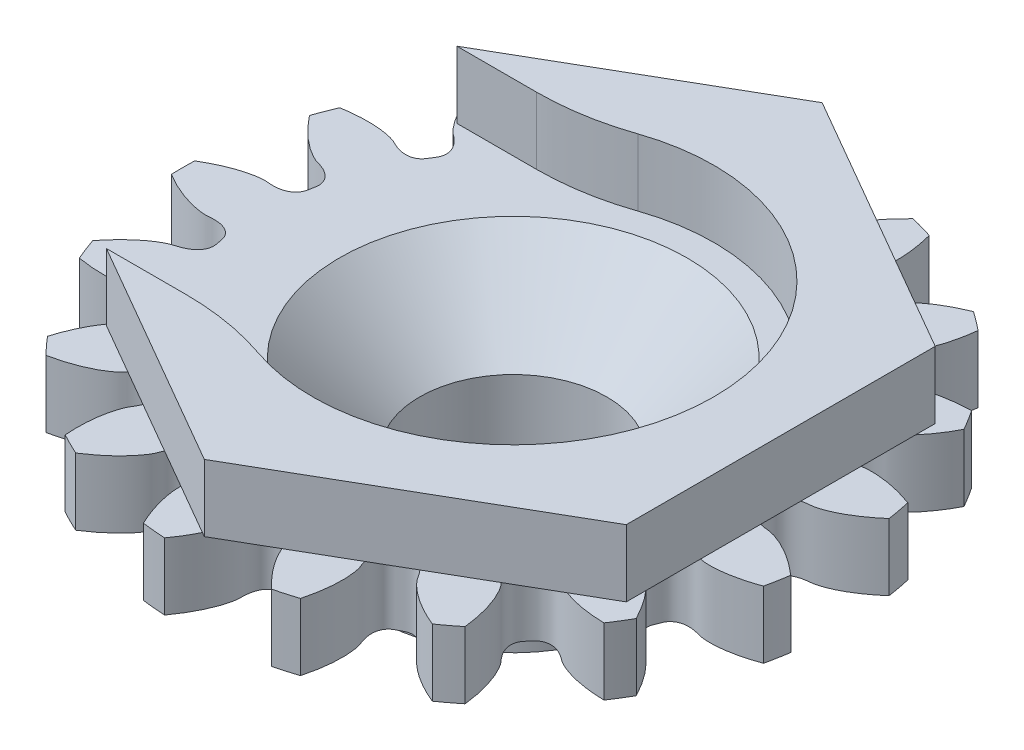
from build123d import *

# Parameters (mm, degrees)
EXTRUDE_1_DEPTH     = 5
SKETCH_2_R          = 15
CUT_EXTRUDE_1_DEPTH = 5
EXTRUDE_START       = 5
SKETCH_3_R          = 15
EXTRUDE_2_DEPTH     = 5
SKETCH_5_W          = 30.472293135
SKETCH_5_H          = 26.2
CUT_EXTRUDE_2_DEPTH = 5
FILLET_1_R          = 20
SKETCH_9_R          = 10
EXTRUDE_3_DEPTH     = 10
SKETCH_11_R         = 15
EXTRUDE_4_DEPTH     = 5
SKETCH_12_R         = 7
CUT_EXTRUDE_4_DEPTH = 20
CHAMFER_1_SIZE      = 6
SKETCH_13_R         = 12.355203176
CUT_EXTRUDE_5_DEPTH = 3
SKETCH_15_R         = 12
SKETCH_15_R_2       = 10
EXTRUDE_5_DEPTH     = 2.9


with BuildPart() as part:
    # 草图1 → 凸台-拉伸1 (new body)
    with BuildSketch(Plane(origin=(0, 0, 0), x_dir=(1, 0, 0), z_dir=(0, 1, 0))):
        with BuildLine():
            ThreePointArc((14.176553775, -20.226598941), (14.885075295, -19.711025218), (15.574863441, -19.170644498))
            add(Edge.make_bspline(
                [(15.574863441, -19.170644498), (15.549480584, -18.941240251), (15.500523651, -18.583545126), (15.413865314, -18.107757722), (15.33610302, -17.748051042), (15.252032601, -17.412716678), (15.163161506, -17.101758813), (15.070990267, -16.815108865), (14.977008929, -16.552626419), (14.882694077, -16.314099749), (14.789505703, -16.099246629), (14.698884311, -15.907715122), (14.612247524, -15.739084864), (14.530988404, -15.592867343), (14.456468632, -15.468509762), (14.3900274, -15.365388616), (14.332944525, -15.282833836), (14.286531146, -15.220068398), (14.177607251, -15.082670207), (14.036715386, -14.946149435), (13.901356566, -14.770704918), (13.822913693, -14.661721891), (13.751712494, -14.551979929), (13.687423627, -14.441444801), (13.630186007, -14.329601856), (13.580147144, -14.215874375), (13.537658748, -14.09948744), (13.503340489, -13.979491528), (13.478228337, -13.854788515), (13.463951482, -13.72425129), (13.462933372, -13.587001656), (13.478477076, -13.442906725), (13.514690312, -13.293412443), (13.575317954, -13.142110485), (13.656558282, -13.00836415), (13.77559226, -12.859232853), (13.933521688, -12.702083349), (14.075428932, -12.530327693), (14.212940991, -12.398041393), (14.338620875, -12.304807066), (14.483683393, -12.230477668), (14.629198622, -12.180625319), (14.771244678, -12.151852519), (14.908002769, -12.140202488), (15.039300447, -12.142373984), (15.165788556, -12.15587287), (15.288439076, -12.178972907), (15.408249859, -12.210541223), (15.526109202, -12.249873181), (15.642756267, -12.29654707), (15.758751699, -12.350362798), (15.87459514, -12.411134554), (15.99035106, -12.479187118), (16.177536497, -12.597780544), (16.326474757, -12.725474841), (16.47333706, -12.821256581), (16.540117239, -12.861680704), (16.627586798, -12.91090288), (16.736398471, -12.967545866), (16.867101381, -13.03027348), (17.02019281, -13.097694712), (17.196097555, -13.168402685), (17.395173509, -13.240965204), (17.617708443, -13.313931908), (17.863919876, -13.385835965), (18.133954122, -13.45519757), (18.427885761, -13.520526902), (18.745717125, -13.580327317), (19.087378051, -13.633098354), (19.452725285, -13.677339384), (19.934478887, -13.719727928), (20.295165323, -13.735472077), (20.525933007, -13.739579901)],
                knots=[0.010676911, 0.010676911, 0.010676911, 0.010676911, 0.058364616, 0.085243058, 0.110585589, 0.134392209, 0.156662918, 0.177397716, 0.196596603, 0.21425958, 0.230386645, 0.2449778, 0.258033043, 0.269552376, 0.279535798, 0.287983309, 0.29489491, 0.3002706, 0.304110379, 0.331113618, 0.34062545, 0.349862158, 0.358855237, 0.367643072, 0.376272627, 0.384801461, 0.393300011, 0.401853859, 0.410565316, 0.419552882, 0.42894596, 0.438870848, 0.449423906, 0.460632045, 0.472412501, 0.481614351, 0.5, 0.518385649, 0.527587499, 0.539367955, 0.550576094, 0.561129152, 0.57105404, 0.580447118, 0.589434684, 0.598146141, 0.606699989, 0.615198539, 0.623727373, 0.632356928, 0.641144763, 0.650137842, 0.65937455, 0.668886382, 0.695889621, 0.6997294, 0.70510509, 0.712016691, 0.720464202, 0.730447624, 0.741966957, 0.7550222, 0.769613355, 0.78574042, 0.803403397, 0.822602284, 0.843337082, 0.865607791, 0.889414411, 0.914756942, 0.941635384, 0.989323089, 0.989323089, 0.989323089, 0.989323089], degree=3))
            ThreePointArc((20.525933007, -13.739579901), (21.000362937, -13.002874228), (21.448363196, -12.249803994))
            add(Edge.make_bspline(
                [(21.448363196, -12.249803994), (21.341824014, -12.04506025), (21.166958651, -11.729204763), (20.914277924, -11.316850824), (20.711825703, -11.009525315), (20.512295628, -10.727205071), (20.317094862, -10.46934944), (20.127597837, -10.235352416), (19.945143253, -10.024544799), (19.771031502, -9.836195758), (19.606522031, -9.669514713), (19.452830939, -9.523653125), (19.311128266, -9.39770691), (19.182536532, -9.290717312), (19.068125774, -9.201676968), (18.968919516, -9.129520704), (18.885869094, -9.073161377), (18.819916416, -9.031400795), (18.668713957, -8.942628648), (18.488019214, -8.866222831), (18.298423004, -8.751522937), (18.185907993, -8.678236125), (18.079871483, -8.601625632), (17.979994006, -8.521778513), (17.886219183, -8.438164685), (17.798476228, -8.35019309), (17.716813169, -8.257014084), (17.641464823, -8.157518413), (17.573000514, -8.050307873), (17.512532259, -7.933742931), (17.462002612, -7.806129242), (17.424443591, -7.666149687), (17.404207865, -7.513668691), (17.406084886, -7.350682587), (17.433524488, -7.196620452), (17.490647928, -7.014559626), (17.581143785, -6.810971388), (17.651423049, -6.5995512), (17.731861902, -6.426522813), (17.815374781, -6.294183581), (17.923790674, -6.172470856), (18.041470839, -6.073418761), (18.163530907, -5.99527597), (18.286845553, -5.935009919), (18.410061426, -5.889604587), (18.532884435, -5.856499149), (18.655597335, -5.833732813), (18.778721354, -5.819888744), (18.90283026, -5.813988997), (19.028460962, -5.815373323), (19.156063965, -5.823652611), (19.286038047, -5.838473109), (19.418560649, -5.860114374), (19.635946758, -5.903080271), (19.82095605, -5.968348951), (19.992501424, -6.004609981), (20.069374964, -6.01818057), (20.168719, -6.032481232), (20.290644669, -6.045991934), (20.435181331, -6.057268355), (20.602290195, -6.064833779), (20.791859151, -6.067222876), (21.003704555, -6.062970881), (21.237570814, -6.050621416), (21.49313088, -6.028728124), (21.769986617, -5.995858274), (22.067669385, -5.950595707), (22.385640707, -5.891544001), (22.72329313, -5.817329366), (23.079950983, -5.726604253), (23.544485346, -5.59210092), (23.886502874, -5.476486932), (24.103171248, -5.396954462)],
                knots=[0.010676911, 0.010676911, 0.010676911, 0.010676911, 0.058364616, 0.085243058, 0.110585589, 0.134392209, 0.156662918, 0.177397716, 0.196596603, 0.21425958, 0.230386645, 0.2449778, 0.258033043, 0.269552376, 0.279535798, 0.287983309, 0.29489491, 0.3002706, 0.304110379, 0.331113618, 0.34062545, 0.349862158, 0.358855237, 0.367643072, 0.376272627, 0.384801461, 0.393300011, 0.401853859, 0.410565316, 0.419552882, 0.42894596, 0.438870848, 0.449423906, 0.460632045, 0.472412501, 0.481614351, 0.5, 0.518385649, 0.527587499, 0.539367955, 0.550576094, 0.561129152, 0.57105404, 0.580447118, 0.589434684, 0.598146141, 0.606699989, 0.615198539, 0.623727373, 0.632356928, 0.641144763, 0.650137842, 0.65937455, 0.668886382, 0.695889621, 0.6997294, 0.70510509, 0.712016691, 0.720464202, 0.730447624, 0.741966957, 0.7550222, 0.769613355, 0.78574042, 0.803403397, 0.822602284, 0.843337082, 0.865607791, 0.889414411, 0.914756942, 0.941635384, 0.989323089, 0.989323089, 0.989323089, 0.989323089], degree=3))
            ThreePointArc((24.103171248, -5.396954462), (24.279435198, -4.538613022), (24.425142652, -3.674559583))
            add(Edge.make_bspline(
                [(24.425142652, -3.674559583), (24.251835852, -3.522128119), (23.974678595, -3.290770304), (23.59010141, -2.997540514), (23.290301557, -2.784102188), (23.002259468, -2.592924978), (22.727091977, -2.422996413), (22.465861788, -2.273254907), (22.219575461, -2.142592856), (21.989181566, -2.029859025), (21.775568915, -1.933861255), (21.579564957, -1.853369001), (21.401934129, -1.787116563), (21.243376808, -1.733804426), (21.104526871, -1.692106711), (20.985953941, -1.660660433), (20.888152392, -1.638108199), (20.811567689, -1.62299247), (20.638507396, -1.594835537), (20.442413602, -1.588863704), (20.22418602, -1.550399289), (20.092794648, -1.522706482), (19.966243644, -1.489574131), (19.844266564, -1.451198815), (19.726619347, -1.407106617), (19.613022473, -1.356771958), (19.503213799, -1.299385223), (19.397011577, -1.233827235), (19.294441596, -1.158588544), (19.195948513, -1.071738626), (19.10273164, -0.970995819), (19.017142448, -0.854036654), (18.943190706, -0.719162347), (18.886063604, -0.566504273), (18.855996608, -0.412933284), (18.843494674, -0.222531253), (18.854334993, 0), (18.843494674, 0.222531253), (18.855996608, 0.412933284), (18.886063604, 0.566504273), (18.943190706, 0.719162347), (19.017142448, 0.854036654), (19.10273164, 0.970995819), (19.195948513, 1.071738626), (19.294441596, 1.158588544), (19.397011577, 1.233827235), (19.503213799, 1.299385223), (19.613022473, 1.356771958), (19.726619347, 1.407106617), (19.844266564, 1.451198815), (19.966243644, 1.489574131), (20.092794648, 1.522706482), (20.22418602, 1.550399289), (20.442413602, 1.588863704), (20.638507396, 1.594835537), (20.811567689, 1.62299247), (20.888152392, 1.638108199), (20.985953941, 1.660660433), (21.104526871, 1.692106711), (21.243376808, 1.733804426), (21.401934129, 1.787116563), (21.579564957, 1.853369001), (21.775568915, 1.933861255), (21.989181566, 2.029859025), (22.219575461, 2.142592856), (22.465861788, 2.273254907), (22.727091977, 2.422996413), (23.002259468, 2.592924978), (23.290301557, 2.784102188), (23.59010141, 2.997540514), (23.974678595, 3.290770304), (24.251835852, 3.522128119), (24.425142652, 3.674559583)],
                knots=[0.010676911, 0.010676911, 0.010676911, 0.010676911, 0.058364616, 0.085243058, 0.110585589, 0.134392209, 0.156662918, 0.177397716, 0.196596603, 0.21425958, 0.230386645, 0.2449778, 0.258033043, 0.269552376, 0.279535798, 0.287983309, 0.29489491, 0.3002706, 0.304110379, 0.331113618, 0.34062545, 0.349862158, 0.358855237, 0.367643072, 0.376272627, 0.384801461, 0.393300011, 0.401853859, 0.410565316, 0.419552882, 0.42894596, 0.438870848, 0.449423906, 0.460632045, 0.472412501, 0.481614351, 0.5, 0.518385649, 0.527587499, 0.539367955, 0.550576094, 0.561129152, 0.57105404, 0.580447118, 0.589434684, 0.598146141, 0.606699989, 0.615198539, 0.623727373, 0.632356928, 0.641144763, 0.650137842, 0.65937455, 0.668886382, 0.695889621, 0.6997294, 0.70510509, 0.712016691, 0.720464202, 0.730447624, 0.741966957, 0.7550222, 0.769613355, 0.78574042, 0.803403397, 0.822602284, 0.843337082, 0.865607791, 0.889414411, 0.914756942, 0.941635384, 0.989323089, 0.989323089, 0.989323089, 0.989323089], degree=3))
            ThreePointArc((24.425142652, 3.674559583), (24.279435198, 4.538613022), (24.103171248, 5.396954462))
            add(Edge.make_bspline(
                [(24.103171248, 5.396954462), (23.886502874, 5.476486932), (23.544485346, 5.59210092), (23.079950983, 5.726604253), (22.72329313, 5.817329366), (22.385640707, 5.891544001), (22.067669385, 5.950595707), (21.769986617, 5.995858274), (21.49313088, 6.028728124), (21.237570814, 6.050621416), (21.003704555, 6.062970881), (20.791859151, 6.067222876), (20.602290195, 6.064833779), (20.435181331, 6.057268355), (20.290644669, 6.045991934), (20.168719, 6.032481232), (20.069374964, 6.01818057), (19.992501424, 6.004609981), (19.82095605, 5.968348951), (19.635946758, 5.903080271), (19.418560649, 5.860114374), (19.286038047, 5.838473109), (19.156063965, 5.823652611), (19.028460962, 5.815373323), (18.90283026, 5.813988997), (18.778721354, 5.819888744), (18.655597335, 5.833732813), (18.532884435, 5.856499149), (18.410061426, 5.889604587), (18.286845553, 5.935009919), (18.163530907, 5.99527597), (18.041470839, 6.073418761), (17.923790674, 6.172470856), (17.815374781, 6.294183581), (17.731861902, 6.426522813), (17.651423049, 6.5995512), (17.581143785, 6.810971388), (17.490647928, 7.014559626), (17.433524488, 7.196620452), (17.406084886, 7.350682587), (17.404207865, 7.513668691), (17.424443591, 7.666149687), (17.462002612, 7.806129242), (17.512532259, 7.933742931), (17.573000514, 8.050307873), (17.641464823, 8.157518413), (17.716813169, 8.257014084), (17.798476228, 8.35019309), (17.886219183, 8.438164685), (17.979994006, 8.521778513), (18.079871483, 8.601625632), (18.185907993, 8.678236125), (18.298423004, 8.751522937), (18.488019214, 8.866222831), (18.668713957, 8.942628648), (18.819916416, 9.031400795), (18.885869094, 9.073161377), (18.968919516, 9.129520704), (19.068125774, 9.201676968), (19.182536532, 9.290717312), (19.311128266, 9.39770691), (19.452830939, 9.523653125), (19.606522031, 9.669514713), (19.771031502, 9.836195758), (19.945143253, 10.024544799), (20.127597837, 10.235352416), (20.317094862, 10.46934944), (20.512295628, 10.727205071), (20.711825703, 11.009525315), (20.914277924, 11.316850824), (21.166958651, 11.729204763), (21.341824014, 12.04506025), (21.448363196, 12.249803994)],
                knots=[0.010676911, 0.010676911, 0.010676911, 0.010676911, 0.058364616, 0.085243058, 0.110585589, 0.134392209, 0.156662918, 0.177397716, 0.196596603, 0.21425958, 0.230386645, 0.2449778, 0.258033043, 0.269552376, 0.279535798, 0.287983309, 0.29489491, 0.3002706, 0.304110379, 0.331113618, 0.34062545, 0.349862158, 0.358855237, 0.367643072, 0.376272627, 0.384801461, 0.393300011, 0.401853859, 0.410565316, 0.419552882, 0.42894596, 0.438870848, 0.449423906, 0.460632045, 0.472412501, 0.481614351, 0.5, 0.518385649, 0.527587499, 0.539367955, 0.550576094, 0.561129152, 0.57105404, 0.580447118, 0.589434684, 0.598146141, 0.606699989, 0.615198539, 0.623727373, 0.632356928, 0.641144763, 0.650137842, 0.65937455, 0.668886382, 0.695889621, 0.6997294, 0.70510509, 0.712016691, 0.720464202, 0.730447624, 0.741966957, 0.7550222, 0.769613355, 0.78574042, 0.803403397, 0.822602284, 0.843337082, 0.865607791, 0.889414411, 0.914756942, 0.941635384, 0.989323089, 0.989323089, 0.989323089, 0.989323089], degree=3))
            ThreePointArc((21.448363196, 12.249803994), (21.000362937, 13.002874228), (20.525933007, 13.739579901))
            add(Edge.make_bspline(
                [(20.525933007, 13.739579901), (20.295165323, 13.735472077), (19.934478887, 13.719727928), (19.452725285, 13.677339384), (19.087378051, 13.633098354), (18.745717125, 13.580327317), (18.427885761, 13.520526902), (18.133954122, 13.45519757), (17.863919876, 13.385835965), (17.617708443, 13.313931908), (17.395173509, 13.240965204), (17.196097555, 13.168402685), (17.02019281, 13.097694712), (16.867101381, 13.03027348), (16.736398471, 12.967545866), (16.627586798, 12.91090288), (16.540117239, 12.861680704), (16.47333706, 12.821256581), (16.326474757, 12.725474841), (16.177536497, 12.597780544), (15.99035106, 12.479187118), (15.87459514, 12.411134554), (15.758751699, 12.350362798), (15.642756267, 12.29654707), (15.526109202, 12.249873181), (15.408249859, 12.210541223), (15.288439076, 12.178972907), (15.165788556, 12.15587287), (15.039300447, 12.142373984), (14.908002769, 12.140202488), (14.771244678, 12.151852519), (14.629198622, 12.180625319), (14.483683393, 12.230477668), (14.338620875, 12.304807066), (14.212940991, 12.398041393), (14.075428932, 12.530327693), (13.933521688, 12.702083349), (13.77559226, 12.859232853), (13.656558282, 13.00836415), (13.575317954, 13.142110485), (13.514690312, 13.293412443), (13.478477076, 13.442906725), (13.462933372, 13.587001656), (13.463951482, 13.72425129), (13.478228337, 13.854788515), (13.503340489, 13.979491528), (13.537658748, 14.09948744), (13.580147144, 14.215874375), (13.630186007, 14.329601856), (13.687423627, 14.441444801), (13.751712494, 14.551979929), (13.822913693, 14.661721891), (13.901356566, 14.770704918), (14.036715386, 14.946149435), (14.177607251, 15.082670207), (14.286531146, 15.220068398), (14.332944525, 15.282833836), (14.3900274, 15.365388616), (14.456468632, 15.468509762), (14.530988404, 15.592867343), (14.612247524, 15.739084864), (14.698884311, 15.907715122), (14.789505703, 16.099246629), (14.882694077, 16.314099749), (14.977008929, 16.552626419), (15.070990267, 16.815108865), (15.163161506, 17.101758813), (15.252032601, 17.412716678), (15.33610302, 17.748051042), (15.413865314, 18.107757722), (15.500523651, 18.583545126), (15.549480584, 18.941240251), (15.574863441, 19.170644498)],
                knots=[0.010676911, 0.010676911, 0.010676911, 0.010676911, 0.058364616, 0.085243058, 0.110585589, 0.134392209, 0.156662918, 0.177397716, 0.196596603, 0.21425958, 0.230386645, 0.2449778, 0.258033043, 0.269552376, 0.279535798, 0.287983309, 0.29489491, 0.3002706, 0.304110379, 0.331113618, 0.34062545, 0.349862158, 0.358855237, 0.367643072, 0.376272627, 0.384801461, 0.393300011, 0.401853859, 0.410565316, 0.419552882, 0.42894596, 0.438870848, 0.449423906, 0.460632045, 0.472412501, 0.481614351, 0.5, 0.518385649, 0.527587499, 0.539367955, 0.550576094, 0.561129152, 0.57105404, 0.580447118, 0.589434684, 0.598146141, 0.606699989, 0.615198539, 0.623727373, 0.632356928, 0.641144763, 0.650137842, 0.65937455, 0.668886382, 0.695889621, 0.6997294, 0.70510509, 0.712016691, 0.720464202, 0.730447624, 0.741966957, 0.7550222, 0.769613355, 0.78574042, 0.803403397, 0.822602284, 0.843337082, 0.865607791, 0.889414411, 0.914756942, 0.941635384, 0.989323089, 0.989323089, 0.989323089, 0.989323089], degree=3))
            ThreePointArc((15.574863441, 19.170644498), (14.885075295, 19.711025218), (14.176553775, 20.226598941))
            add(Edge.make_bspline(
                [(14.176553775, 20.226598941), (13.962853236, 20.139405606), (13.632210593, 19.994429656), (13.198301247, 19.780874041), (12.8736068, 19.607641867), (12.574080572, 19.435012178), (12.299314053, 19.26443602), (12.048830639, 19.097337877), (11.822087505, 18.935112486), (11.618476922, 18.779122121), (11.437327891, 18.630693805), (11.277907698, 18.491116742), (11.139424073, 18.361639398), (11.021025926, 18.243467969), (10.92180892, 18.137760873), (10.840806863, 18.045635551), (10.777025029, 17.96813959), (10.729357244, 17.906321435), (10.627012581, 17.76395484), (10.53426029, 17.591080749), (10.402555954, 17.412876493), (10.319200195, 17.307603506), (10.233132695, 17.209088053), (10.144410658, 17.117003998), (10.052501063, 17.031344113), (9.956808841, 16.952092449), (9.856492404, 16.879375224), (9.750468896, 16.813528602), (9.637398607, 16.755248491), (9.515751604, 16.705793439), (9.384020005, 16.667254049), (9.241172069, 16.642770932), (9.087474412, 16.636690699), (8.925356768, 16.653598173), (8.774483642, 16.695135783), (8.598470142, 16.768813999), (8.404100279, 16.877708569), (8.200066525, 16.967195428), (8.035198207, 17.063256189), (7.911129108, 17.15862354), (7.799938944, 17.277807183), (7.712167544, 17.40412472), (7.645620379, 17.532874208), (7.596989452, 17.661223465), (7.563146738, 17.788103197), (7.541515199, 17.913456848), (7.530168498, 18.037746889), (7.527743937, 18.161623053), (7.533320683, 18.285746892), (7.546290842, 18.410713946), (7.566308532, 18.537008701), (7.593058303, 18.665060873), (7.626834893, 18.795021353), (7.689675365, 19.007515738), (7.771736124, 19.185713579), (7.823670681, 19.353181426), (7.844276376, 19.4284749), (7.867682345, 19.526075653), (7.892385294, 19.646234599), (7.916949773, 19.789114236), (7.939901785, 19.954812194), (7.959771907, 20.143352044), (7.975084678, 20.354686078), (7.98436635, 20.58869417), (7.986146559, 20.845184119), (7.97896195, 21.123891686), (7.961359166, 21.424480894), (7.931898057, 21.74654441), (7.889154643, 22.08960413), (7.831724783, 22.453111601), (7.740657041, 22.928074745), (7.657093638, 23.279300799), (7.597892075, 23.502383234)],
                knots=[0.010676911, 0.010676911, 0.010676911, 0.010676911, 0.058364616, 0.085243058, 0.110585589, 0.134392209, 0.156662918, 0.177397716, 0.196596603, 0.21425958, 0.230386645, 0.2449778, 0.258033043, 0.269552376, 0.279535798, 0.287983309, 0.29489491, 0.3002706, 0.304110379, 0.331113618, 0.34062545, 0.349862158, 0.358855237, 0.367643072, 0.376272627, 0.384801461, 0.393300011, 0.401853859, 0.410565316, 0.419552882, 0.42894596, 0.438870848, 0.449423906, 0.460632045, 0.472412501, 0.481614351, 0.5, 0.518385649, 0.527587499, 0.539367955, 0.550576094, 0.561129152, 0.57105404, 0.580447118, 0.589434684, 0.598146141, 0.606699989, 0.615198539, 0.623727373, 0.632356928, 0.641144763, 0.650137842, 0.65937455, 0.668886382, 0.695889621, 0.6997294, 0.70510509, 0.712016691, 0.720464202, 0.730447624, 0.741966957, 0.7550222, 0.769613355, 0.78574042, 0.803403397, 0.822602284, 0.843337082, 0.865607791, 0.889414411, 0.914756942, 0.941635384, 0.989323089, 0.989323089, 0.989323089, 0.989323089], degree=3))
            ThreePointArc((7.597892075, 23.502383234), (6.759475753, 23.75709303), (5.912552401, 23.981903715))
            add(Edge.make_bspline(
                [(5.912552401, 23.981903715), (5.744780449, 23.823400812), (5.48883672, 23.568772865), (5.161373491, 23.21289205), (4.921183615, 22.934064695), (4.704244762, 22.66489095), (4.509651829, 22.406576305), (4.336445813, 22.160276881), (4.183616709, 21.927097142), (4.050105714, 21.708087832), (3.934807764, 21.504243972), (3.836573912, 21.31650302), (3.75421439, 21.145742937), (3.686499849, 20.992781017), (3.632168554, 20.85837077), (3.58991589, 20.743205148), (3.558435871, 20.64790166), (3.536318279, 20.573038357), (3.492313469, 20.403314304), (3.468273858, 20.208608022), (3.409838025, 19.994860409), (3.370140084, 19.866584699), (3.325472416, 19.743630608), (3.276006178, 19.625714687), (3.221246953, 19.512637648), (3.160645616, 19.404169655), (3.093371816, 19.300124384), (3.018294382, 19.20042413), (2.933912683, 19.105233845), (2.838345455, 19.015174416), (2.729431431, 18.931650563), (2.60507402, 18.85721811), (2.463951657, 18.796026464), (2.306673771, 18.753228566), (2.150983656, 18.737459574), (1.960240314, 18.742579055), (1.739658559, 18.773905724), (1.517076366, 18.783644242), (1.32864009, 18.813660928), (1.17849844, 18.857769406), (1.031762602, 18.928738324), (0.904287051, 19.014819232), (0.795723988, 19.110834945), (0.7040119, 19.212949546), (0.626620263, 19.319035974), (0.561166491, 19.42811056), (0.505687267, 19.53990867), (0.458677199, 19.6545439), (0.419038657, 19.772300486), (0.385989663, 19.893514155), (0.359032676, 20.01851173), (0.337718315, 20.147579957), (0.322266906, 20.280966007), (0.304102075, 20.501811717), (0.31624897, 20.697620021), (0.304180138, 20.872540063), (0.296195236, 20.950192772), (0.282763194, 21.049657975), (0.26239159, 21.17062659), (0.233683206, 21.312731597), (0.195228313, 21.475531564), (0.145648201, 21.658517655), (0.083584276, 21.861112383), (0.007705704, 22.082671357), (-0.083289157, 22.322484197), (-0.190669391, 22.579775883), (-0.315668845, 22.853708113), (-0.459483272, 23.143380818), (-0.623267783, 23.447833778), (-0.808133578, 23.766048341), (-1.064628195, 24.17604082), (-1.269426233, 24.473362779), (-1.405216717, 24.659994883)],
                knots=[0.010676911, 0.010676911, 0.010676911, 0.010676911, 0.058364616, 0.085243058, 0.110585589, 0.134392209, 0.156662918, 0.177397716, 0.196596603, 0.21425958, 0.230386645, 0.2449778, 0.258033043, 0.269552376, 0.279535798, 0.287983309, 0.29489491, 0.3002706, 0.304110379, 0.331113618, 0.34062545, 0.349862158, 0.358855237, 0.367643072, 0.376272627, 0.384801461, 0.393300011, 0.401853859, 0.410565316, 0.419552882, 0.42894596, 0.438870848, 0.449423906, 0.460632045, 0.472412501, 0.481614351, 0.5, 0.518385649, 0.527587499, 0.539367955, 0.550576094, 0.561129152, 0.57105404, 0.580447118, 0.589434684, 0.598146141, 0.606699989, 0.615198539, 0.623727373, 0.632356928, 0.641144763, 0.650137842, 0.65937455, 0.668886382, 0.695889621, 0.6997294, 0.70510509, 0.712016691, 0.720464202, 0.730447624, 0.741966957, 0.7550222, 0.769613355, 0.78574042, 0.803403397, 0.822602284, 0.843337082, 0.865607791, 0.889414411, 0.914756942, 0.941635384, 0.989323089, 0.989323089, 0.989323089, 0.989323089], degree=3))
            ThreePointArc((-1.405216717, 24.659994883), (-2.279028445, 24.594633785), (-3.149971937, 24.498319503))
            add(Edge.make_bspline(
                [(-3.149971937, 24.498319503), (-3.249156771, 24.289913729), (-3.395834966, 23.9600227), (-3.572626355, 23.509880361), (-3.695872686, 23.163115004), (-3.80092537, 22.833750609), (-3.889063863, 22.522584301), (-3.961600048, 22.230347699), (-4.019874707, 21.957705827), (-4.065254714, 21.705255993), (-4.099129954, 21.473526831), (-4.122910439, 21.262977447), (-4.13802275, 21.07399672), (-4.145908459, 20.906902664), (-4.148016302, 20.761942114), (-4.145813116, 20.639289947), (-4.140739769, 20.539050197), (-4.134320065, 20.46125245), (-4.114041929, 20.287093112), (-4.066122177, 20.096850803), (-4.043397425, 19.876427632), (-4.034076121, 19.742473544), (-4.03131134, 19.611686446), (-4.03484109, 19.483863858), (-4.045054408, 19.358641346), (-4.062380313, 19.235606226), (-4.087525777, 19.114284802), (-4.121517513, 18.994195986), (-4.165814407, 18.874951503), (-4.222394974, 18.756450722), (-4.293781981, 18.639222765), (-4.382853711, 18.524893491), (-4.492341423, 18.416854703), (-4.6235383, 18.320131526), (-4.763018591, 18.249185623), (-4.942730831, 18.185054953), (-5.15973369, 18.134582881), (-5.370803361, 18.063257817), (-5.557358234, 18.023176508), (-5.713294973, 18.01006902), (-5.875758998, 18.023238466), (-6.025722419, 18.057457042), (-6.161639337, 18.107771527), (-6.28404636, 18.169860328), (-6.394534751, 18.240825892), (-6.49497086, 18.318890285), (-6.587089832, 18.403097511), (-6.672336436, 18.493009684), (-6.751836861, 18.588495337), (-6.826441558, 18.689585044), (-6.896732532, 18.796403825), (-6.963232404, 18.909056726), (-7.025825012, 19.027853821), (-7.122541884, 19.227224419), (-7.181949361, 19.414198189), (-7.256391618, 19.572946505), (-7.291888712, 19.642471021), (-7.340344694, 19.730367348), (-7.403039553, 19.835808149), (-7.481143573, 19.957946458), (-7.575811824, 20.095861396), (-7.688146102, 20.248580442), (-7.819204646, 20.415074324), (-7.969995639, 20.594261413), (-8.141476211, 20.785009092), (-8.334549774, 20.986136229), (-8.550064029, 21.196415415), (-8.788808839, 21.414575405), (-9.051514442, 21.639303545), (-9.33884902, 21.869248561), (-9.726129494, 22.158898618), (-10.024503057, 22.362161504), (-10.218543205, 22.487137578)],
                knots=[0.010676911, 0.010676911, 0.010676911, 0.010676911, 0.058364616, 0.085243058, 0.110585589, 0.134392209, 0.156662918, 0.177397716, 0.196596603, 0.21425958, 0.230386645, 0.2449778, 0.258033043, 0.269552376, 0.279535798, 0.287983309, 0.29489491, 0.3002706, 0.304110379, 0.331113618, 0.34062545, 0.349862158, 0.358855237, 0.367643072, 0.376272627, 0.384801461, 0.393300011, 0.401853859, 0.410565316, 0.419552882, 0.42894596, 0.438870848, 0.449423906, 0.460632045, 0.472412501, 0.481614351, 0.5, 0.518385649, 0.527587499, 0.539367955, 0.550576094, 0.561129152, 0.57105404, 0.580447118, 0.589434684, 0.598146141, 0.606699989, 0.615198539, 0.623727373, 0.632356928, 0.641144763, 0.650137842, 0.65937455, 0.668886382, 0.695889621, 0.6997294, 0.70510509, 0.712016691, 0.720464202, 0.730447624, 0.741966957, 0.7550222, 0.769613355, 0.78574042, 0.803403397, 0.822602284, 0.843337082, 0.865607791, 0.889414411, 0.914756942, 0.941635384, 0.989323089, 0.989323089, 0.989323089, 0.989323089], degree=3))
            ThreePointArc((-10.218543205, 22.487137578), (-11.009737222, 22.110532964), (-11.787075111, 21.706101493))
            add(Edge.make_bspline(
                [(-11.787075111, 21.706101493), (-11.804277365, 21.475939201), (-11.821880324, 21.115338703), (-11.824123216, 20.631729056), (-11.813780901, 20.263858281), (-11.792759469, 19.918785723), (-11.76253993, 19.596792485), (-11.724609872, 19.298086877), (-11.680459768, 19.022804668), (-11.631579966, 18.771009059), (-11.579457458, 18.542690903), (-11.52557289, 18.337768947), (-11.471396987, 18.156090472), (-11.418388857, 17.997431258), (-11.367988571, 17.861498129), (-11.321627088, 17.747924272), (-11.280685559, 17.656286193), (-11.246595576, 17.58606102), (-11.164773167, 17.430987581), (-11.051365881, 17.270902522), (-10.950549647, 17.073573164), (-10.893467991, 16.95203194), (-10.843644161, 16.831075357), (-10.80076071, 16.710609251), (-10.765048757, 16.59015326), (-10.73675927, 16.469167589), (-10.716380363, 16.34695514), (-10.704695629, 16.222696423), (-10.702925177, 16.09550237), (-10.712877566, 15.964564425), (-10.737096345, 15.829464649), (-10.778852761, 15.690679356), (-10.8419189, 15.550384663), (-10.929315903, 15.412799208), (-11.033748785, 15.29625803), (-11.178158788, 15.171538413), (-11.362275313, 15.046084133), (-11.533326335, 14.903328332), (-11.692804534, 14.798562232), (-11.833476242, 14.730009015), (-11.989726785, 14.683600383), (-12.141924687, 14.661335218), (-12.286839126, 14.659153224), (-12.423409339, 14.672830791), (-12.552072413, 14.699091198), (-12.673926407, 14.735602369), (-12.790243949, 14.780846058), (-12.902214063, 14.833892037), (-13.010839398, 14.894210891), (-13.11692402, 14.96152391), (-13.221055796, 15.035737428), (-13.323760001, 15.116760606), (-13.42504033, 15.20492454), (-13.587247095, 15.355893921), (-13.710185633, 15.508781314), (-13.836947478, 15.629918065), (-13.895162684, 15.681924716), (-13.972098357, 15.74638128), (-14.068649183, 15.822053904), (-14.185600458, 15.907730058), (-14.323696596, 16.002133792), (-14.483613673, 16.103960239), (-14.665966652, 16.211867354), (-14.871304909, 16.324482348), (-15.100111789, 16.440403334), (-15.352803027, 16.558202588), (-15.629725688, 16.676429361), (-15.931157072, 16.79361292), (-16.257303919, 16.908265461), (-16.608301154, 17.018885581), (-17.074063111, 17.149074372), (-17.425715195, 17.230826405), (-17.65179881, 17.277267737)],
                knots=[0.010676911, 0.010676911, 0.010676911, 0.010676911, 0.058364616, 0.085243058, 0.110585589, 0.134392209, 0.156662918, 0.177397716, 0.196596603, 0.21425958, 0.230386645, 0.2449778, 0.258033043, 0.269552376, 0.279535798, 0.287983309, 0.29489491, 0.3002706, 0.304110379, 0.331113618, 0.34062545, 0.349862158, 0.358855237, 0.367643072, 0.376272627, 0.384801461, 0.393300011, 0.401853859, 0.410565316, 0.419552882, 0.42894596, 0.438870848, 0.449423906, 0.460632045, 0.472412501, 0.481614351, 0.5, 0.518385649, 0.527587499, 0.539367955, 0.550576094, 0.561129152, 0.57105404, 0.580447118, 0.589434684, 0.598146141, 0.606699989, 0.615198539, 0.623727373, 0.632356928, 0.641144763, 0.650137842, 0.65937455, 0.668886382, 0.695889621, 0.6997294, 0.70510509, 0.712016691, 0.720464202, 0.730447624, 0.741966957, 0.7550222, 0.769613355, 0.78574042, 0.803403397, 0.822602284, 0.843337082, 0.865607791, 0.889414411, 0.914756942, 0.941635384, 0.989323089, 0.989323089, 0.989323089, 0.989323089], degree=3))
            ThreePointArc((-17.65179881, 17.277267737), (-18.253519981, 16.640282148), (-18.832268476, 15.982354198))
            add(Edge.make_bspline(
                [(-18.832268476, 15.982354198), (-18.765164891, 15.761520082), (-18.651315236, 15.418911209), (-18.478706716, 14.967148417), (-18.336172543, 14.627855211), (-18.191916056, 14.313678451), (-18.047419802, 14.024345255), (-17.904146164, 13.759512488), (-17.763534014, 13.51876833), (-17.626995891, 13.301633338), (-17.495915069, 13.107561819), (-17.371642856, 12.935943138), (-17.255495496, 12.786103598), (-17.148752569, 12.657307032), (-17.052650991, 12.548759848), (-16.968392587, 12.45960308), (-16.897112255, 12.388942903), (-16.839956034, 12.335774601), (-16.707639923, 12.220730589), (-16.544061384, 12.112423154), (-16.37876946, 11.964838032), (-16.281636647, 11.872124488), (-16.191482751, 11.777334277), (-16.107977748, 11.680494268), (-16.03116362, 11.581073047), (-15.961079394, 11.47847661), (-15.8979284, 11.371878606), (-15.842145285, 11.260231815), (-15.794546596, 11.142266455), (-15.75652668, 11.016575239), (-15.73030635, 10.881849618), (-15.719108019, 10.737352028), (-15.727235154, 10.583749006), (-15.759028833, 10.423882952), (-15.814310066, 10.277486031), (-15.903914461, 10.109021542), (-16.030278694, 9.92552835), (-16.138209678, 9.730621773), (-16.249072789, 9.575320124), (-16.355480972, 9.460579671), (-16.484415534, 9.360860704), (-16.618292745, 9.285118833), (-16.752633208, 9.23073505), (-16.884922045, 9.19415415), (-17.014383142, 9.172162787), (-17.141197964, 9.1621897), (-17.266004747, 9.162359441), (-17.389576187, 9.171375073), (-17.512655979, 9.188380732), (-17.63589321, 9.212826068), (-17.759802214, 9.244411376), (-17.884839981, 9.282862201), (-18.011129562, 9.328485946), (-18.216919296, 9.41066486), (-18.386785365, 9.508817585), (-18.548746907, 9.575982582), (-18.621817939, 9.603447582), (-18.716842714, 9.635759167), (-18.834209783, 9.671443606), (-18.974213396, 9.709086567), (-19.137086771, 9.747229348), (-19.32298896, 9.784410971), (-19.532008595, 9.819157865), (-19.764162045, 9.849991485), (-20.019393597, 9.875430007), (-20.297575158, 9.893991936), (-20.598506286, 9.904199115), (-20.921914264, 9.904579955), (-21.267454417, 9.893672435), (-21.634710188, 9.870027798), (-22.116049893, 9.823172605), (-22.473487937, 9.772372721), (-22.701081174, 9.734007151)],
                knots=[0.010676911, 0.010676911, 0.010676911, 0.010676911, 0.058364616, 0.085243058, 0.110585589, 0.134392209, 0.156662918, 0.177397716, 0.196596603, 0.21425958, 0.230386645, 0.2449778, 0.258033043, 0.269552376, 0.279535798, 0.287983309, 0.29489491, 0.3002706, 0.304110379, 0.331113618, 0.34062545, 0.349862158, 0.358855237, 0.367643072, 0.376272627, 0.384801461, 0.393300011, 0.401853859, 0.410565316, 0.419552882, 0.42894596, 0.438870848, 0.449423906, 0.460632045, 0.472412501, 0.481614351, 0.5, 0.518385649, 0.527587499, 0.539367955, 0.550576094, 0.561129152, 0.57105404, 0.580447118, 0.589434684, 0.598146141, 0.606699989, 0.615198539, 0.623727373, 0.632356928, 0.641144763, 0.650137842, 0.65937455, 0.668886382, 0.695889621, 0.6997294, 0.70510509, 0.712016691, 0.720464202, 0.730447624, 0.741966957, 0.7550222, 0.769613355, 0.78574042, 0.803403397, 0.822602284, 0.843337082, 0.865607791, 0.889414411, 0.914756942, 0.941635384, 0.989323089, 0.989323089, 0.989323089, 0.989323089], degree=3))
            ThreePointArc((-22.701081174, 9.734007151), (-23.03206372, 8.922669021), (-23.334059631, 8.100101408))
            add(Edge.make_bspline(
                [(-23.334059631, 8.100101408), (-23.191712917, 7.918420338), (-22.961786676, 7.640074317), (-22.63763848, 7.281171449), (-22.382162479, 7.016279239), (-22.134153574, 6.775429589), (-21.894895625, 6.557832486), (-21.665628306, 6.362639693), (-21.447544561, 6.188947418), (-21.241788347, 6.035798328), (-21.049452401, 5.902183881), (-20.871576196, 5.787046528), (-20.709143723, 5.689282584), (-20.563082221, 5.607743356), (-20.434258403, 5.541242015), (-20.323482642, 5.488543451), (-20.231490312, 5.448404224), (-20.158987116, 5.419473467), (-19.994047327, 5.359996214), (-19.802389724, 5.318093922), (-19.594945699, 5.240185224), (-19.470880054, 5.188820839), (-19.352571876, 5.132998943), (-19.239723133, 5.07286381), (-19.132181004, 5.007904746), (-19.029767302, 4.93755376), (-18.932373114, 4.860966852), (-18.840025435, 4.777010506), (-18.753026976, 4.684205713), (-18.672169556, 4.580736522), (-18.599051319, 4.464580497), (-18.536410636, 4.333885812), (-18.488501152, 4.1877194), (-18.460397595, 4.027163542), (-18.459061142, 3.870682595), (-18.481758359, 3.681225296), (-18.533304111, 3.464474964), (-18.563538379, 3.243740825), (-18.610813725, 3.058877975), (-18.668587369, 2.913446619), (-18.752792621, 2.773884916), (-18.850268282, 2.654895698), (-18.955891346, 2.555654958), (-19.066032467, 2.473756044), (-19.178807149, 2.406482967), (-19.293455753, 2.351372543), (-19.40989593, 2.306445411), (-19.528379688, 2.270213085), (-19.649291329, 2.241608841), (-19.773037298, 2.219885015), (-19.899988932, 2.204576342), (-20.030473218, 2.195261817), (-20.164715943, 2.192183634), (-20.386295603, 2.194473363), (-20.580147849, 2.224635351), (-20.755435284, 2.228757588), (-20.833493495, 2.227971637), (-20.933773749, 2.223774384), (-21.056105988, 2.214651258), (-21.200253675, 2.199177135), (-21.365907336, 2.175907569), (-21.552687516, 2.143422784), (-21.760144547, 2.100316696), (-21.987759581, 2.045204692), (-22.234945369, 1.976725136), (-22.501047292, 1.893542849), (-22.78534447, 1.794351898), (-23.087051003, 1.677878583), (-23.405317349, 1.542884123), (-23.739231728, 1.388168069), (-24.171141589, 1.170596946), (-24.486091604, 0.99410595), (-24.684456734, 0.876114962)],
                knots=[0.010676911, 0.010676911, 0.010676911, 0.010676911, 0.058364616, 0.085243058, 0.110585589, 0.134392209, 0.156662918, 0.177397716, 0.196596603, 0.21425958, 0.230386645, 0.2449778, 0.258033043, 0.269552376, 0.279535798, 0.287983309, 0.29489491, 0.3002706, 0.304110379, 0.331113618, 0.34062545, 0.349862158, 0.358855237, 0.367643072, 0.376272627, 0.384801461, 0.393300011, 0.401853859, 0.410565316, 0.419552882, 0.42894596, 0.438870848, 0.449423906, 0.460632045, 0.472412501, 0.481614351, 0.5, 0.518385649, 0.527587499, 0.539367955, 0.550576094, 0.561129152, 0.57105404, 0.580447118, 0.589434684, 0.598146141, 0.606699989, 0.615198539, 0.623727373, 0.632356928, 0.641144763, 0.650137842, 0.65937455, 0.668886382, 0.695889621, 0.6997294, 0.70510509, 0.712016691, 0.720464202, 0.730447624, 0.741966957, 0.7550222, 0.769613355, 0.78574042, 0.803403397, 0.822602284, 0.843337082, 0.865607791, 0.889414411, 0.914756942, 0.941635384, 0.989323089, 0.989323089, 0.989323089, 0.989323089], degree=3))
            ThreePointArc((-24.684456734, 0.876114962), (-24.699999629, 0), (-24.684456734, -0.876114962))
            add(Edge.make_bspline(
                [(-24.684456734, -0.876114962), (-24.486091604, -0.99410595), (-24.171141589, -1.170596946), (-23.739231728, -1.388168069), (-23.405317349, -1.542884123), (-23.087051003, -1.677878583), (-22.78534447, -1.794351898), (-22.501047292, -1.893542849), (-22.234945369, -1.976725136), (-21.987759581, -2.045204692), (-21.760144547, -2.100316696), (-21.552687516, -2.143422784), (-21.365907336, -2.175907569), (-21.200253675, -2.199177135), (-21.056105988, -2.214651258), (-20.933773749, -2.223774384), (-20.833493495, -2.227971637), (-20.755435284, -2.228757588), (-20.580147849, -2.224635351), (-20.386295603, -2.194473363), (-20.164715943, -2.192183634), (-20.030473218, -2.195261817), (-19.899988932, -2.204576342), (-19.773037298, -2.219885015), (-19.649291329, -2.241608841), (-19.528379688, -2.270213085), (-19.40989593, -2.306445411), (-19.293455753, -2.351372543), (-19.178807149, -2.406482967), (-19.066032467, -2.473756044), (-18.955891346, -2.555654958), (-18.850268282, -2.654895698), (-18.752792621, -2.773884916), (-18.668587369, -2.913446619), (-18.610813725, -3.058877975), (-18.563538379, -3.243740825), (-18.533304111, -3.464474964), (-18.481758359, -3.681225296), (-18.459061142, -3.870682595), (-18.460397595, -4.027163542), (-18.488501152, -4.1877194), (-18.536410636, -4.333885812), (-18.599051319, -4.464580497), (-18.672169556, -4.580736522), (-18.753026976, -4.684205713), (-18.840025435, -4.777010506), (-18.932373114, -4.860966852), (-19.029767302, -4.93755376), (-19.132181004, -5.007904746), (-19.239723133, -5.07286381), (-19.352571876, -5.132998943), (-19.470880054, -5.188820839), (-19.594945699, -5.240185224), (-19.802389724, -5.318093922), (-19.994047327, -5.359996214), (-20.158987116, -5.419473467), (-20.231490312, -5.448404224), (-20.323482642, -5.488543451), (-20.434258403, -5.541242015), (-20.563082221, -5.607743356), (-20.709143723, -5.689282584), (-20.871576196, -5.787046528), (-21.049452401, -5.902183881), (-21.241788347, -6.035798328), (-21.447544561, -6.188947418), (-21.665628306, -6.362639693), (-21.894895625, -6.557832486), (-22.134153574, -6.775429589), (-22.382162479, -7.016279239), (-22.63763848, -7.281171449), (-22.961786676, -7.640074317), (-23.191712917, -7.918420338), (-23.334059631, -8.100101408)],
                knots=[0.010676911, 0.010676911, 0.010676911, 0.010676911, 0.058364616, 0.085243058, 0.110585589, 0.134392209, 0.156662918, 0.177397716, 0.196596603, 0.21425958, 0.230386645, 0.2449778, 0.258033043, 0.269552376, 0.279535798, 0.287983309, 0.29489491, 0.3002706, 0.304110379, 0.331113618, 0.34062545, 0.349862158, 0.358855237, 0.367643072, 0.376272627, 0.384801461, 0.393300011, 0.401853859, 0.410565316, 0.419552882, 0.42894596, 0.438870848, 0.449423906, 0.460632045, 0.472412501, 0.481614351, 0.5, 0.518385649, 0.527587499, 0.539367955, 0.550576094, 0.561129152, 0.57105404, 0.580447118, 0.589434684, 0.598146141, 0.606699989, 0.615198539, 0.623727373, 0.632356928, 0.641144763, 0.650137842, 0.65937455, 0.668886382, 0.695889621, 0.6997294, 0.70510509, 0.712016691, 0.720464202, 0.730447624, 0.741966957, 0.7550222, 0.769613355, 0.78574042, 0.803403397, 0.822602284, 0.843337082, 0.865607791, 0.889414411, 0.914756942, 0.941635384, 0.989323089, 0.989323089, 0.989323089, 0.989323089], degree=3))
            ThreePointArc((-23.334059631, -8.100101408), (-23.03206372, -8.922669021), (-22.701081174, -9.734007151))
            add(Edge.make_bspline(
                [(-22.701081174, -9.734007151), (-22.473487937, -9.772372721), (-22.116049893, -9.823172605), (-21.634710188, -9.870027798), (-21.267454417, -9.893672435), (-20.921914264, -9.904579955), (-20.598506286, -9.904199115), (-20.297575158, -9.893991936), (-20.019393597, -9.875430007), (-19.764162045, -9.849991485), (-19.532008595, -9.819157865), (-19.32298896, -9.784410971), (-19.137086771, -9.747229348), (-18.974213396, -9.709086567), (-18.834209783, -9.671443606), (-18.716842714, -9.635759167), (-18.621817939, -9.603447582), (-18.548746907, -9.575982582), (-18.386785365, -9.508817585), (-18.216919296, -9.41066486), (-18.011129562, -9.328485946), (-17.884839981, -9.282862201), (-17.759802214, -9.244411376), (-17.63589321, -9.212826068), (-17.512655979, -9.188380732), (-17.389576187, -9.171375073), (-17.266004747, -9.162359441), (-17.141197964, -9.1621897), (-17.014383142, -9.172162787), (-16.884922045, -9.19415415), (-16.752633208, -9.23073505), (-16.618292745, -9.285118833), (-16.484415534, -9.360860704), (-16.355480972, -9.460579671), (-16.249072789, -9.575320124), (-16.138209678, -9.730621773), (-16.030278694, -9.92552835), (-15.903914461, -10.109021542), (-15.814310066, -10.277486031), (-15.759028833, -10.423882952), (-15.727235154, -10.583749006), (-15.719108019, -10.737352028), (-15.73030635, -10.881849618), (-15.75652668, -11.016575239), (-15.794546596, -11.142266455), (-15.842145285, -11.260231815), (-15.8979284, -11.371878606), (-15.961079394, -11.47847661), (-16.03116362, -11.581073047), (-16.107977748, -11.680494268), (-16.191482751, -11.777334277), (-16.281636647, -11.872124488), (-16.37876946, -11.964838032), (-16.544061384, -12.112423154), (-16.707639923, -12.220730589), (-16.839956034, -12.335774601), (-16.897112255, -12.388942903), (-16.968392587, -12.45960308), (-17.052650991, -12.548759848), (-17.148752569, -12.657307032), (-17.255495496, -12.786103598), (-17.371642856, -12.935943138), (-17.495915069, -13.107561819), (-17.626995891, -13.301633338), (-17.763534014, -13.51876833), (-17.904146164, -13.759512488), (-18.047419802, -14.024345255), (-18.191916056, -14.313678451), (-18.336172543, -14.627855211), (-18.478706716, -14.967148417), (-18.651315236, -15.418911209), (-18.765164891, -15.761520082), (-18.832268476, -15.982354198)],
                knots=[0.010676911, 0.010676911, 0.010676911, 0.010676911, 0.058364616, 0.085243058, 0.110585589, 0.134392209, 0.156662918, 0.177397716, 0.196596603, 0.21425958, 0.230386645, 0.2449778, 0.258033043, 0.269552376, 0.279535798, 0.287983309, 0.29489491, 0.3002706, 0.304110379, 0.331113618, 0.34062545, 0.349862158, 0.358855237, 0.367643072, 0.376272627, 0.384801461, 0.393300011, 0.401853859, 0.410565316, 0.419552882, 0.42894596, 0.438870848, 0.449423906, 0.460632045, 0.472412501, 0.481614351, 0.5, 0.518385649, 0.527587499, 0.539367955, 0.550576094, 0.561129152, 0.57105404, 0.580447118, 0.589434684, 0.598146141, 0.606699989, 0.615198539, 0.623727373, 0.632356928, 0.641144763, 0.650137842, 0.65937455, 0.668886382, 0.695889621, 0.6997294, 0.70510509, 0.712016691, 0.720464202, 0.730447624, 0.741966957, 0.7550222, 0.769613355, 0.78574042, 0.803403397, 0.822602284, 0.843337082, 0.865607791, 0.889414411, 0.914756942, 0.941635384, 0.989323089, 0.989323089, 0.989323089, 0.989323089], degree=3))
            ThreePointArc((-18.832268476, -15.982354198), (-18.253519981, -16.640282148), (-17.65179881, -17.277267737))
            add(Edge.make_bspline(
                [(-17.65179881, -17.277267737), (-17.425715195, -17.230826405), (-17.074063111, -17.149074372), (-16.608301154, -17.018885581), (-16.257303919, -16.908265461), (-15.931157072, -16.79361292), (-15.629725688, -16.676429361), (-15.352803027, -16.558202588), (-15.100111789, -16.440403334), (-14.871304909, -16.324482348), (-14.665966652, -16.211867354), (-14.483613673, -16.103960239), (-14.323696596, -16.002133792), (-14.185600458, -15.907730058), (-14.068649183, -15.822053904), (-13.972098357, -15.74638128), (-13.895162684, -15.681924716), (-13.836947478, -15.629918065), (-13.710185633, -15.508781314), (-13.587247095, -15.355893921), (-13.42504033, -15.20492454), (-13.323760001, -15.116760606), (-13.221055796, -15.035737428), (-13.11692402, -14.96152391), (-13.010839398, -14.894210891), (-12.902214063, -14.833892037), (-12.790243949, -14.780846058), (-12.673926407, -14.735602369), (-12.552072413, -14.699091198), (-12.423409339, -14.672830791), (-12.286839126, -14.659153224), (-12.141924687, -14.661335218), (-11.989726785, -14.683600383), (-11.833476242, -14.730009015), (-11.692804534, -14.798562232), (-11.533326335, -14.903328332), (-11.362275313, -15.046084133), (-11.178158788, -15.171538413), (-11.033748785, -15.29625803), (-10.929315903, -15.412799208), (-10.8419189, -15.550384663), (-10.778852761, -15.690679356), (-10.737096345, -15.829464649), (-10.712877566, -15.964564425), (-10.702925177, -16.09550237), (-10.704695629, -16.222696423), (-10.716380363, -16.34695514), (-10.73675927, -16.469167589), (-10.765048757, -16.59015326), (-10.80076071, -16.710609251), (-10.843644161, -16.831075357), (-10.893467991, -16.95203194), (-10.950549647, -17.073573164), (-11.051365881, -17.270902522), (-11.164773167, -17.430987581), (-11.246595576, -17.58606102), (-11.280685559, -17.656286193), (-11.321627088, -17.747924272), (-11.367988571, -17.861498129), (-11.418388857, -17.997431258), (-11.471396987, -18.156090472), (-11.52557289, -18.337768947), (-11.579457458, -18.542690903), (-11.631579966, -18.771009059), (-11.680459768, -19.022804668), (-11.724609872, -19.298086877), (-11.76253993, -19.596792485), (-11.792759469, -19.918785723), (-11.813780901, -20.263858281), (-11.824123216, -20.631729056), (-11.821880324, -21.115338703), (-11.804277365, -21.475939201), (-11.787075111, -21.706101493)],
                knots=[0.010676911, 0.010676911, 0.010676911, 0.010676911, 0.058364616, 0.085243058, 0.110585589, 0.134392209, 0.156662918, 0.177397716, 0.196596603, 0.21425958, 0.230386645, 0.2449778, 0.258033043, 0.269552376, 0.279535798, 0.287983309, 0.29489491, 0.3002706, 0.304110379, 0.331113618, 0.34062545, 0.349862158, 0.358855237, 0.367643072, 0.376272627, 0.384801461, 0.393300011, 0.401853859, 0.410565316, 0.419552882, 0.42894596, 0.438870848, 0.449423906, 0.460632045, 0.472412501, 0.481614351, 0.5, 0.518385649, 0.527587499, 0.539367955, 0.550576094, 0.561129152, 0.57105404, 0.580447118, 0.589434684, 0.598146141, 0.606699989, 0.615198539, 0.623727373, 0.632356928, 0.641144763, 0.650137842, 0.65937455, 0.668886382, 0.695889621, 0.6997294, 0.70510509, 0.712016691, 0.720464202, 0.730447624, 0.741966957, 0.7550222, 0.769613355, 0.78574042, 0.803403397, 0.822602284, 0.843337082, 0.865607791, 0.889414411, 0.914756942, 0.941635384, 0.989323089, 0.989323089, 0.989323089, 0.989323089], degree=3))
            ThreePointArc((-11.787075111, -21.706101493), (-11.009737222, -22.110532964), (-10.218543205, -22.487137578))
            add(Edge.make_bspline(
                [(-10.218543205, -22.487137578), (-10.024503057, -22.362161504), (-9.726129494, -22.158898618), (-9.33884902, -21.869248561), (-9.051514442, -21.639303545), (-8.788808839, -21.414575405), (-8.550064029, -21.196415415), (-8.334549774, -20.986136229), (-8.141476211, -20.785009092), (-7.969995639, -20.594261413), (-7.819204646, -20.415074324), (-7.688146102, -20.248580442), (-7.575811824, -20.095861396), (-7.481143573, -19.957946458), (-7.403039553, -19.835808149), (-7.340344694, -19.730367348), (-7.291888712, -19.642471021), (-7.256391618, -19.572946505), (-7.181949361, -19.414198189), (-7.122541884, -19.227224419), (-7.025825012, -19.027853821), (-6.963232404, -18.909056726), (-6.896732532, -18.796403825), (-6.826441558, -18.689585044), (-6.751836861, -18.588495337), (-6.672336436, -18.493009684), (-6.587089832, -18.403097511), (-6.49497086, -18.318890285), (-6.394534751, -18.240825892), (-6.28404636, -18.169860328), (-6.161639337, -18.107771527), (-6.025722419, -18.057457042), (-5.875758998, -18.023238466), (-5.713294973, -18.01006902), (-5.557358234, -18.023176508), (-5.370803361, -18.063257817), (-5.15973369, -18.134582881), (-4.942730831, -18.185054953), (-4.763018591, -18.249185623), (-4.6235383, -18.320131526), (-4.492341423, -18.416854703), (-4.382853711, -18.524893491), (-4.293781981, -18.639222765), (-4.222394974, -18.756450722), (-4.165814407, -18.874951503), (-4.121517513, -18.994195986), (-4.087525777, -19.114284802), (-4.062380313, -19.235606226), (-4.045054408, -19.358641346), (-4.03484109, -19.483863858), (-4.03131134, -19.611686446), (-4.034076121, -19.742473544), (-4.043397425, -19.876427632), (-4.066122177, -20.096850803), (-4.114041929, -20.287093112), (-4.134320065, -20.46125245), (-4.140739769, -20.539050197), (-4.145813116, -20.639289947), (-4.148016302, -20.761942114), (-4.145908459, -20.906902664), (-4.13802275, -21.07399672), (-4.122910439, -21.262977447), (-4.099129954, -21.473526831), (-4.065254714, -21.705255993), (-4.019874707, -21.957705827), (-3.961600048, -22.230347699), (-3.889063863, -22.522584301), (-3.80092537, -22.833750609), (-3.695872686, -23.163115004), (-3.572626355, -23.509880361), (-3.395834966, -23.9600227), (-3.249156771, -24.289913729), (-3.149971937, -24.498319503)],
                knots=[0.010676911, 0.010676911, 0.010676911, 0.010676911, 0.058364616, 0.085243058, 0.110585589, 0.134392209, 0.156662918, 0.177397716, 0.196596603, 0.21425958, 0.230386645, 0.2449778, 0.258033043, 0.269552376, 0.279535798, 0.287983309, 0.29489491, 0.3002706, 0.304110379, 0.331113618, 0.34062545, 0.349862158, 0.358855237, 0.367643072, 0.376272627, 0.384801461, 0.393300011, 0.401853859, 0.410565316, 0.419552882, 0.42894596, 0.438870848, 0.449423906, 0.460632045, 0.472412501, 0.481614351, 0.5, 0.518385649, 0.527587499, 0.539367955, 0.550576094, 0.561129152, 0.57105404, 0.580447118, 0.589434684, 0.598146141, 0.606699989, 0.615198539, 0.623727373, 0.632356928, 0.641144763, 0.650137842, 0.65937455, 0.668886382, 0.695889621, 0.6997294, 0.70510509, 0.712016691, 0.720464202, 0.730447624, 0.741966957, 0.7550222, 0.769613355, 0.78574042, 0.803403397, 0.822602284, 0.843337082, 0.865607791, 0.889414411, 0.914756942, 0.941635384, 0.989323089, 0.989323089, 0.989323089, 0.989323089], degree=3))
            ThreePointArc((-3.149971937, -24.498319503), (-2.279028445, -24.594633785), (-1.405216717, -24.659994883))
            add(Edge.make_bspline(
                [(-1.405216717, -24.659994883), (-1.269426233, -24.473362779), (-1.064628195, -24.17604082), (-0.808133578, -23.766048341), (-0.623267783, -23.447833778), (-0.459483272, -23.143380818), (-0.315668845, -22.853708113), (-0.190669391, -22.579775883), (-0.083289157, -22.322484197), (0.007705704, -22.082671357), (0.083584276, -21.861112383), (0.145648201, -21.658517655), (0.195228313, -21.475531564), (0.233683206, -21.312731597), (0.26239159, -21.17062659), (0.282763194, -21.049657975), (0.296195236, -20.950192772), (0.304180138, -20.872540063), (0.31624897, -20.697620021), (0.304102075, -20.501811717), (0.322266906, -20.280966007), (0.337718315, -20.147579957), (0.359032676, -20.01851173), (0.385989663, -19.893514155), (0.419038657, -19.772300486), (0.458677199, -19.6545439), (0.505687267, -19.53990867), (0.561166491, -19.42811056), (0.626620263, -19.319035974), (0.7040119, -19.212949546), (0.795723988, -19.110834945), (0.904287051, -19.014819232), (1.031762602, -18.928738324), (1.17849844, -18.857769406), (1.32864009, -18.813660928), (1.517076366, -18.783644242), (1.739658559, -18.773905724), (1.960240314, -18.742579055), (2.150983656, -18.737459574), (2.306673771, -18.753228566), (2.463951657, -18.796026464), (2.60507402, -18.85721811), (2.729431431, -18.931650563), (2.838345455, -19.015174416), (2.933912683, -19.105233845), (3.018294382, -19.20042413), (3.093371816, -19.300124384), (3.160645616, -19.404169655), (3.221246953, -19.512637648), (3.276006178, -19.625714687), (3.325472416, -19.743630608), (3.370140084, -19.866584699), (3.409838025, -19.994860409), (3.468273858, -20.208608022), (3.492313469, -20.403314304), (3.536318279, -20.573038357), (3.558435871, -20.64790166), (3.58991589, -20.743205148), (3.632168554, -20.85837077), (3.686499849, -20.992781017), (3.75421439, -21.145742937), (3.836573912, -21.31650302), (3.934807764, -21.504243972), (4.050105714, -21.708087832), (4.183616709, -21.927097142), (4.336445813, -22.160276881), (4.509651829, -22.406576305), (4.704244762, -22.66489095), (4.921183615, -22.934064695), (5.161373491, -23.21289205), (5.48883672, -23.568772865), (5.744780449, -23.823400812), (5.912552401, -23.981903715)],
                knots=[0.010676911, 0.010676911, 0.010676911, 0.010676911, 0.058364616, 0.085243058, 0.110585589, 0.134392209, 0.156662918, 0.177397716, 0.196596603, 0.21425958, 0.230386645, 0.2449778, 0.258033043, 0.269552376, 0.279535798, 0.287983309, 0.29489491, 0.3002706, 0.304110379, 0.331113618, 0.34062545, 0.349862158, 0.358855237, 0.367643072, 0.376272627, 0.384801461, 0.393300011, 0.401853859, 0.410565316, 0.419552882, 0.42894596, 0.438870848, 0.449423906, 0.460632045, 0.472412501, 0.481614351, 0.5, 0.518385649, 0.527587499, 0.539367955, 0.550576094, 0.561129152, 0.57105404, 0.580447118, 0.589434684, 0.598146141, 0.606699989, 0.615198539, 0.623727373, 0.632356928, 0.641144763, 0.650137842, 0.65937455, 0.668886382, 0.695889621, 0.6997294, 0.70510509, 0.712016691, 0.720464202, 0.730447624, 0.741966957, 0.7550222, 0.769613355, 0.78574042, 0.803403397, 0.822602284, 0.843337082, 0.865607791, 0.889414411, 0.914756942, 0.941635384, 0.989323089, 0.989323089, 0.989323089, 0.989323089], degree=3))
            ThreePointArc((5.912552401, -23.981903715), (6.759475753, -23.75709303), (7.597892075, -23.502383234))
            add(Edge.make_bspline(
                [(7.597892075, -23.502383234), (7.657093638, -23.279300799), (7.740657041, -22.928074745), (7.831724783, -22.453111601), (7.889154643, -22.08960413), (7.931898057, -21.74654441), (7.961359166, -21.424480894), (7.97896195, -21.123891686), (7.986146559, -20.845184119), (7.98436635, -20.58869417), (7.975084678, -20.354686078), (7.959771907, -20.143352044), (7.939901785, -19.954812194), (7.916949773, -19.789114236), (7.892385294, -19.646234599), (7.867682345, -19.526075653), (7.844276376, -19.4284749), (7.823670681, -19.353181426), (7.771736124, -19.185713579), (7.689675365, -19.007515738), (7.626834893, -18.795021353), (7.593058303, -18.665060873), (7.566308532, -18.537008701), (7.546290842, -18.410713946), (7.533320683, -18.285746892), (7.527743937, -18.161623053), (7.530168498, -18.037746889), (7.541515199, -17.913456848), (7.563146738, -17.788103197), (7.596989452, -17.661223465), (7.645620379, -17.532874208), (7.712167544, -17.40412472), (7.799938944, -17.277807183), (7.911129108, -17.15862354), (8.035198207, -17.063256189), (8.200066525, -16.967195428), (8.404100279, -16.877708569), (8.598470142, -16.768813999), (8.774483642, -16.695135783), (8.925356768, -16.653598173), (9.087474412, -16.636690699), (9.241172069, -16.642770932), (9.384020005, -16.667254049), (9.515751604, -16.705793439), (9.637398607, -16.755248491), (9.750468896, -16.813528602), (9.856492404, -16.879375224), (9.956808841, -16.952092449), (10.052501063, -17.031344113), (10.144410658, -17.117003998), (10.233132695, -17.209088053), (10.319200195, -17.307603506), (10.402555954, -17.412876493), (10.53426029, -17.591080749), (10.627012581, -17.76395484), (10.729357244, -17.906321435), (10.777025029, -17.96813959), (10.840806863, -18.045635551), (10.92180892, -18.137760873), (11.021025926, -18.243467969), (11.139424073, -18.361639398), (11.277907698, -18.491116742), (11.437327891, -18.630693805), (11.618476922, -18.779122121), (11.822087505, -18.935112486), (12.048830639, -19.097337877), (12.299314053, -19.26443602), (12.574080572, -19.435012178), (12.8736068, -19.607641867), (13.198301247, -19.780874041), (13.632210593, -19.994429656), (13.962853236, -20.139405606), (14.176553775, -20.226598941)],
                knots=[0.010676911, 0.010676911, 0.010676911, 0.010676911, 0.058364616, 0.085243058, 0.110585589, 0.134392209, 0.156662918, 0.177397716, 0.196596603, 0.21425958, 0.230386645, 0.2449778, 0.258033043, 0.269552376, 0.279535798, 0.287983309, 0.29489491, 0.3002706, 0.304110379, 0.331113618, 0.34062545, 0.349862158, 0.358855237, 0.367643072, 0.376272627, 0.384801461, 0.393300011, 0.401853859, 0.410565316, 0.419552882, 0.42894596, 0.438870848, 0.449423906, 0.460632045, 0.472412501, 0.481614351, 0.5, 0.518385649, 0.527587499, 0.539367955, 0.550576094, 0.561129152, 0.57105404, 0.580447118, 0.589434684, 0.598146141, 0.606699989, 0.615198539, 0.623727373, 0.632356928, 0.641144763, 0.650137842, 0.65937455, 0.668886382, 0.695889621, 0.6997294, 0.70510509, 0.712016691, 0.720464202, 0.730447624, 0.741966957, 0.7550222, 0.769613355, 0.78574042, 0.803403397, 0.822602284, 0.843337082, 0.865607791, 0.889414411, 0.914756942, 0.941635384, 0.989323089, 0.989323089, 0.989323089, 0.989323089], degree=3))
        make_face()
    extrude(amount=EXTRUDE_1_DEPTH)

    # 草图2 → 切除-拉伸1 (cut)
    with BuildSketch(Plane(origin=(0, 5, 0), x_dir=(1, 0, 0), z_dir=(0, 1, 0))):
        with Locations(Location((0, 0, 0), (0, 0, 270))):
            Circle(SKETCH_2_R)
    extrude(amount=-CUT_EXTRUDE_1_DEPTH, mode=Mode.SUBTRACT)

    # 草图3 → 凸台-拉伸2 (add)
    with BuildSketch(Plane(origin=(0, 5, 0), x_dir=(1, 0, 0), z_dir=(0, 1, 0)).offset(EXTRUDE_START)):
        Polygon((0, -23.094010768), (20, -11.547005384), (20, 11.547005384), (0, 23.094010768), (-20, 11.547005384), (-20, -11.547005384), align=None)
        with Locations(Location((0, 0, 0), (0, 0, 270))):
            Circle(SKETCH_3_R, mode=Mode.SUBTRACT)
    extrude(amount=-EXTRUDE_2_DEPTH)

    # 草图5 → 切除-拉伸2 (cut)
    with BuildSketch(Plane(origin=(0, 10, 0), x_dir=(1, 0, 0), z_dir=(0, 1, 0))):
        with Locations((-15.236146568, 0)):
            Rectangle(SKETCH_5_W, SKETCH_5_H)
    extrude(amount=-CUT_EXTRUDE_2_DEPTH, mode=Mode.SUBTRACT)

    # 圆角1
    fillet_1_edges = [part.edges().sort_by_distance(p)[0] for p in [
        (-7.306846105, 7.5, 13.1),
        (-7.306846105, 7.5, -13.1),
    ]]
    fillet(fillet_1_edges, radius=FILLET_1_R)



with BuildPart() as body_2:
    # 草图9 → 凸台-拉伸3 (new body)
    with BuildSketch(Plane.XZ):
        with Locations(Location((0, 0, 0), (0, 0, 270))):
            Circle(SKETCH_9_R)
    extrude(amount=EXTRUDE_3_DEPTH)


with BuildPart() as part_1:
    add(part.part)

    add(body_2.part)  # 凸台-拉伸4 merges body 2
    # 草图11 → 凸台-拉伸4 (add)
    with BuildSketch(Plane(origin=(0, 0, 0), x_dir=(1, 0, 0), z_dir=(0, 1, 0)).offset(EXTRUDE_START)):
        Circle(SKETCH_11_R)
    extrude(amount=-EXTRUDE_4_DEPTH)

    # 草图12 → 切除-拉伸4 (cut)
    with BuildSketch(Plane(origin=(0, 5, 0), x_dir=(1, 0, 0), z_dir=(0, 1, 0))):
        with Locations(Location((0, 0, 0), (0, 0, 270))):
            Circle(SKETCH_12_R)
    extrude(amount=-CUT_EXTRUDE_4_DEPTH, mode=Mode.SUBTRACT)

    # 倒角1
    chamfer_1_edges = [part_1.edges().sort_by_distance(p)[0] for p in [
        (0, 5, -7),
    ]]
    chamfer(chamfer_1_edges, length=CHAMFER_1_SIZE)

    # 草图13 → 切除-拉伸5 (cut)
    with BuildSketch(Plane.XZ.offset(10)):
        Circle(SKETCH_13_R)
    extrude(amount=-CUT_EXTRUDE_5_DEPTH, mode=Mode.SUBTRACT)

    # 草图15 → 凸台-拉伸5 (add)
    with BuildSketch(Plane.XZ):
        with Locations(Location((0, 0, 0), (0, 0, 270))):
            Circle(SKETCH_15_R)
        with Locations(Location((0, 0, 0), (0, 0, 270))):
            Circle(SKETCH_15_R_2, mode=Mode.SUBTRACT)
    extrude(amount=EXTRUDE_5_DEPTH)


solid = part_1.part
